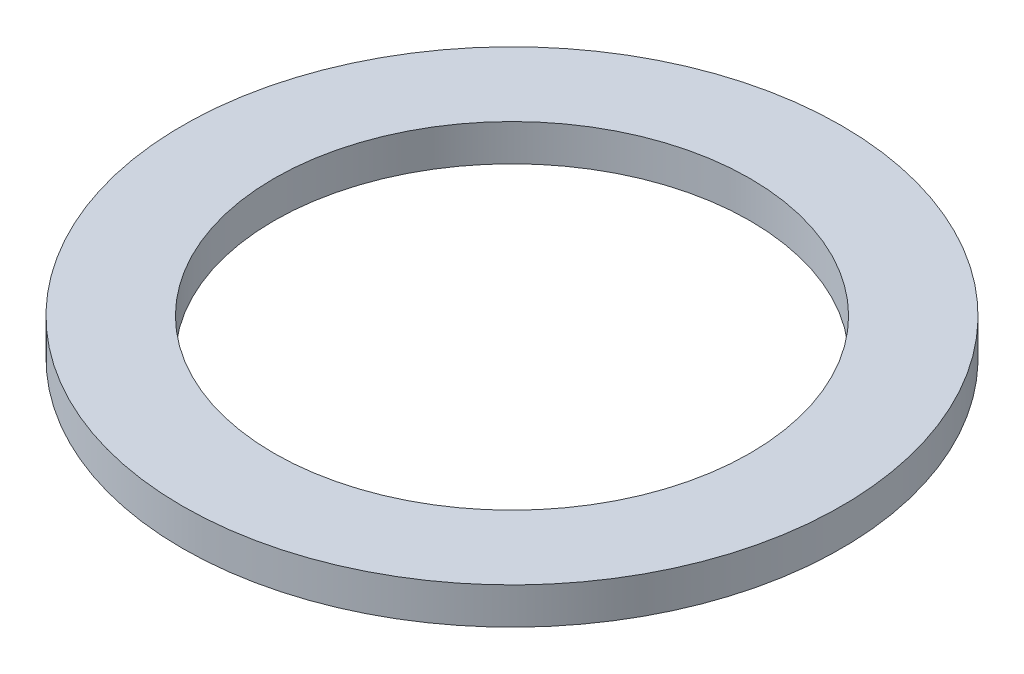
from build123d import *

# Parameters (mm, degrees)
SKETCH_1_R      = 45
SKETCH_1_R_2    = 32.5
EXTRUDE_1_DEPTH = 5


with BuildPart() as part:
    # 草图1 → 凸台-拉伸1 (new body)
    with BuildSketch(Plane(origin=(0, 0, 0), x_dir=(1, 0, 0), z_dir=(0, 1, 0))):
        with Locations(Location((0, 0, 0), (0, 0, 270))):
            Circle(SKETCH_1_R)
        with Locations(Location((0, 0, 0), (0, 0, 270))):
            Circle(SKETCH_1_R_2, mode=Mode.SUBTRACT)
    extrude(amount=EXTRUDE_1_DEPTH)


solid = part.part
